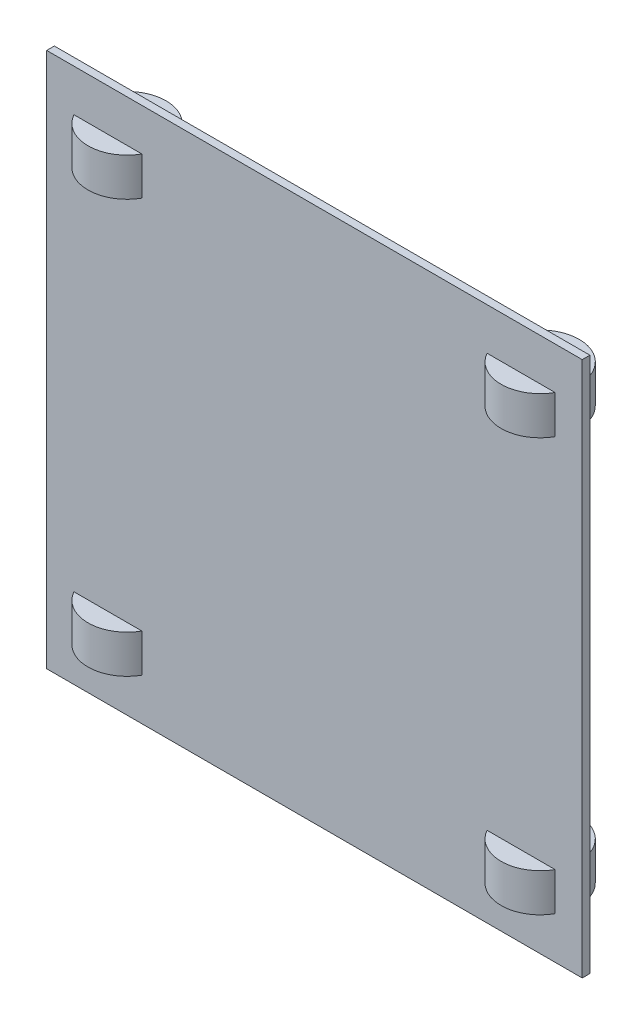
from build123d import *

# Parameters (mm, degrees)
SKETCH_1_W      = 700
SKETCH_1_H      = 700
EXTRUDE_1_DEPTH = 10
SKETCH_2_R      = 51
EXTRUDE_2_DEPTH = 25


with BuildPart() as part:
    # 草图1 → 凸台-拉伸1 (new body)
    with BuildSketch(Plane.XY):
        Rectangle(SKETCH_1_W, SKETCH_1_H)
    extrude(amount=EXTRUDE_1_DEPTH)

    # 草图2 → 凸台-拉伸2 (add, symmetric)
    with BuildSketch(Plane(origin=(0, 270, 0), x_dir=(1, 0, 0), z_dir=(0, 1, 0))):
        with Locations((-270, 15)):
            Circle(SKETCH_2_R)
        with Locations((270, 15)):
            Circle(SKETCH_2_R)
    extrude_2 = extrude(amount=EXTRUDE_2_DEPTH, both=True)

    # 镜向1: 凸台-拉伸2 across plane
    add(extrude_2.mirror(Plane.ZX))


solid = part.part
